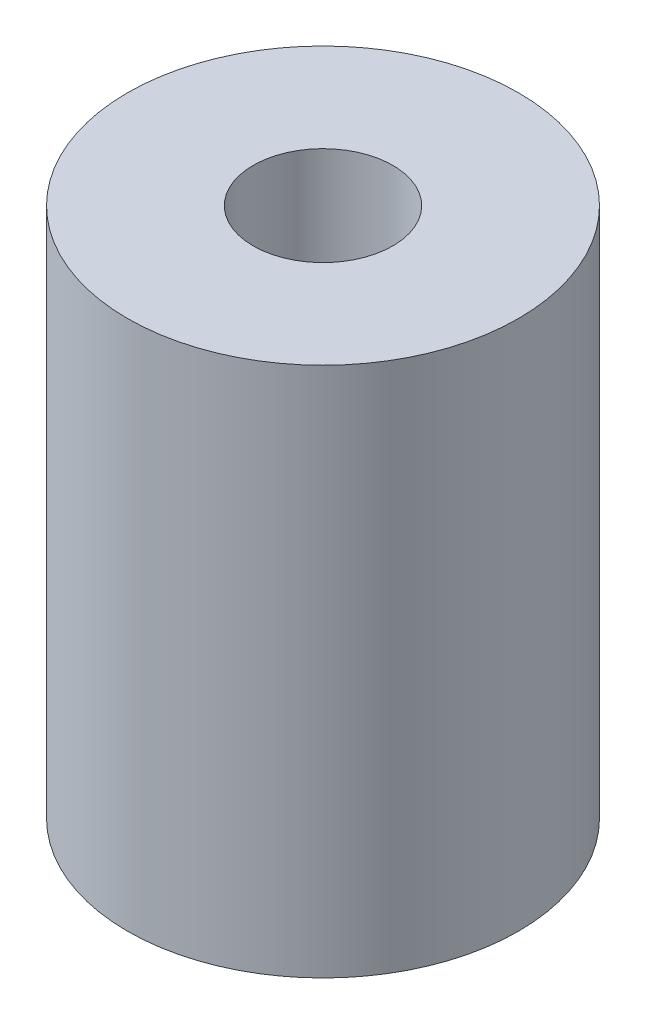
from build123d import *

# Parameters (mm, degrees)
SKETCH1_R           = 7
SKETCH1_R_2         = 2.5
BOSS_EXTRUDE1_DEPTH = 19


with BuildPart() as part:
    # Sketch1 → Boss-Extrude1 (new body)
    with BuildSketch(Plane(origin=(0, 0, 0), x_dir=(1, 0, 0), z_dir=(0, 1, 0))):
        with Locations(Location((0, 0, 0), (0, 0, 270))):
            Circle(SKETCH1_R)
        with Locations(Location((0, 0, 0), (0, 0, 270))):
            Circle(SKETCH1_R_2, mode=Mode.SUBTRACT)
    extrude(amount=BOSS_EXTRUDE1_DEPTH)


solid = part.part
